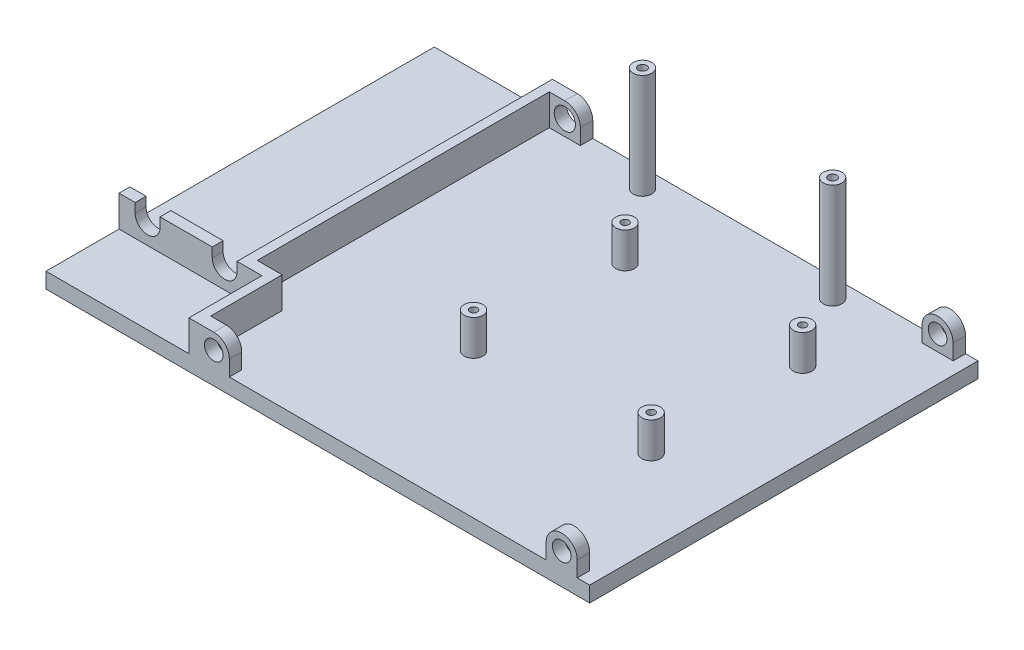
from build123d import *

# Parameters (mm, degrees)
SKETCH1_W           = 175
SKETCH1_H           = 125
BOSS_EXTRUDE1_DEPTH = 5
BOSS_EXTRUDE2_DEPTH = 10
SKETCH3_R           = 3.41
SKETCH3_R_2         = 3
BOSS_EXTRUDE3_DEPTH = 4
BOSS_EXTRUDE4_START = -4
SKETCH4_R           = 3
BOSS_EXTRUDE4_DEPTH = 4
SKETCH5_R           = 3
SKETCH5_R_2         = 1.2
BOSS_EXTRUDE5_DEPTH = 11.4
SKETCH6_R           = 3
SKETCH6_R_2         = 1.35
BOSS_EXTRUDE6_DEPTH = 33.7
CUT_EXTRUDE1_REACH  = 138.96


with BuildPart() as part:
    # Sketch1 → Boss-Extrude1 (new body)
    with BuildSketch(Plane(origin=(0, 0, 0), x_dir=(1, 0, 0), z_dir=(0, 1, 0))):
        Rectangle(SKETCH1_W, SKETCH1_H)
    extrude(amount=BOSS_EXTRUDE1_DEPTH)

    # Sketch2 → Boss-Extrude2 (add)
    with BuildSketch(Plane(origin=(0, 5, 0), x_dir=(1, 0, 0), z_dir=(0, 1, 0))):
        Polygon((-49.5, 62.5), (-49.5, -35.5), (-87.5, -35.5), (-87.5, -39), (-41.5, -39), (-41.5, -62.5), (-38.5, -62.5), (-38.5, -35.5), (-46.5, -35.5), (-46.5, 62.5), align=None)
    extrude(amount=BOSS_EXTRUDE2_DEPTH)

    # Sketch3 → Boss-Extrude3 (add)
    # profile 1 of 2: a face of its own
    with BuildSketch(Plane(origin=(0, 0, -62.5), x_dir=(-1, 0, 0), z_dir=(0, 0, -1))):
        with BuildLine():
            Line((46.5, 5), (36.5, 5))
            Line((36.5, 5), (36.5, 10))
            ThreePointArc((36.5, 10), (37.964466094, 13.535533906), (41.5, 15))
            Line((41.5, 15), (46.5, 15))
            Line((46.5, 15), (46.5, 5))
        make_face()
        with Locations((41.5, 10)):
            Circle(SKETCH3_R, mode=Mode.SUBTRACT)
    # profile 2 of 2: a face of its own
    with BuildSketch(Plane(origin=(0, 0, -62.5), x_dir=(-1, 0, 0), z_dir=(0, 0, -1))):
        with BuildLine():
            Line((-83.5, 10), (-83.5, 5))
            Line((-83.5, 5), (-73.5, 5))
            Line((-73.5, 5), (-73.5, 10))
            ThreePointArc((-73.5, 10), (-78.5, 15), (-83.5, 10))
        make_face()
        with Locations(Location((-78.5, 10, 0), (0, 0, 180))):
            Circle(SKETCH3_R_2, mode=Mode.SUBTRACT)
    extrude(amount=-BOSS_EXTRUDE3_DEPTH)

    # Sketch4 → Boss-Extrude4 (add)
    # profile 1 of 2: a face of its own
    with BuildSketch(Plane.XY.offset(62.5).offset(BOSS_EXTRUDE4_START)):
        with BuildLine():
            Line((73.5, 5), (83.5, 5))
            Line((83.5, 5), (83.5, 10))
            ThreePointArc((83.5, 10), (78.5, 15), (73.5, 10))
            Line((73.5, 10), (73.5, 5))
        make_face()
        with Locations((78.5, 10)):
            Circle(SKETCH4_R, mode=Mode.SUBTRACT)
    # profile 2 of 2: a face of its own
    with BuildSketch(Plane.XY.offset(62.5).offset(BOSS_EXTRUDE4_START)):
        with BuildLine():
            Line((-38.5, 15), (-38.5, 5))
            Line((-38.5, 5), (-28.5, 5))
            Line((-28.5, 5), (-28.5, 10))
            ThreePointArc((-28.5, 10), (-29.964466094, 13.535533906), (-33.5, 15))
            Line((-33.5, 15), (-38.5, 15))
        make_face()
        with Locations((-33.5, 10)):
            Circle(SKETCH4_R, mode=Mode.SUBTRACT)
    extrude(amount=BOSS_EXTRUDE4_DEPTH)

    # Sketch5 → Boss-Extrude5 (add)
    # profile 1 of 4: a face of its own
    with BuildSketch(Plane(origin=(0, 5, 0), x_dir=(1, 0, 0), z_dir=(0, 1, 0))):
        with Locations(Location((3.5, 32.9, 0), (0, 0, 90))):
            Circle(SKETCH5_R)
        with Locations(Location((3.5, 32.9, 0), (0, 0, 90))):
            Circle(SKETCH5_R_2, mode=Mode.SUBTRACT)
    # profile 2 of 4: a face of its own
    with BuildSketch(Plane(origin=(0, 5, 0), x_dir=(1, 0, 0), z_dir=(0, 1, 0))):
        with Locations(Location((60.65, 32.9, 0), (0, 0, 90))):
            Circle(SKETCH5_R)
        with Locations(Location((60.65, 32.9, 0), (0, 0, 90))):
            Circle(SKETCH5_R_2, mode=Mode.SUBTRACT)
    # profile 3 of 4: a face of its own
    with BuildSketch(Plane(origin=(0, 5, 0), x_dir=(1, 0, 0), z_dir=(0, 1, 0))):
        with Locations(Location((60.65, -15.868, 0), (0, 0, 90))):
            Circle(SKETCH5_R)
        with Locations(Location((60.65, -15.868, 0), (0, 0, 90))):
            Circle(SKETCH5_R_2, mode=Mode.SUBTRACT)
    # profile 4 of 4: a face of its own
    with BuildSketch(Plane(origin=(0, 5, 0), x_dir=(1, 0, 0), z_dir=(0, 1, 0))):
        with Locations(Location((3.5, -15.868, 0), (0, 0, 90))):
            Circle(SKETCH5_R)
        with Locations(Location((3.5, -15.868, 0), (0, 0, 90))):
            Circle(SKETCH5_R_2, mode=Mode.SUBTRACT)
    extrude(amount=BOSS_EXTRUDE5_DEPTH)

    # Sketch6 → Boss-Extrude6 (add)
    # profile 1 of 2: a face of its own
    with BuildSketch(Plane(origin=(0, 5, 0), x_dir=(1, 0, 0), z_dir=(0, 1, 0))):
        with Locations(Location((46.7, 56.5, 0), (0, 0, 270))):
            Circle(SKETCH6_R)
        with Locations(Location((46.7, 56.5, 0), (0, 0, 270))):
            Circle(SKETCH6_R_2, mode=Mode.SUBTRACT)
    # profile 2 of 2: a face of its own
    with BuildSketch(Plane(origin=(0, 5, 0), x_dir=(1, 0, 0), z_dir=(0, 1, 0))):
        with Locations(Location((-14.5, 56.5, 0), (0, 0, 270))):
            Circle(SKETCH6_R)
        with Locations(Location((-14.5, 56.5, 0), (0, 0, 270))):
            Circle(SKETCH6_R_2, mode=Mode.SUBTRACT)
    extrude(amount=BOSS_EXTRUDE6_DEPTH)

    # Sketch7 → Cut-Extrude1 (cut, up to next)
    with BuildSketch(Plane(origin=(0, 0, 35.5), x_dir=(-1, 0, 0), z_dir=(0, 0, -1)), mode=Mode.PRIVATE) as cut_extrude1_sk1:
        with BuildLine():
            Line((49.5, 15), (49.5, 12))
            ThreePointArc((49.5, 12), (53.5, 8), (57.5, 12))
            Line((57.5, 12), (57.5, 15))
            Line((57.5, 15), (49.5, 15))
        make_face()
    cut_extrude1_tool1 = extrude(cut_extrude1_sk1.sketch, amount=-CUT_EXTRUDE1_REACH, mode=Mode.PRIVATE) & part.part
    # Sketch7 → Cut-Extrude1 (cut, up to next)
    with BuildSketch(Plane(origin=(0, 0, 35.5), x_dir=(-1, 0, 0), z_dir=(0, 0, -1)), mode=Mode.PRIVATE) as cut_extrude1_sk2:
        with BuildLine():
            Line((74.3, 15), (74.3, 12))
            ThreePointArc((74.3, 12), (78.3, 8), (82.3, 12))
            Line((82.3, 12), (82.3, 15))
            Line((82.3, 15), (74.3, 15))
        make_face()
    cut_extrude1_tool2 = extrude(cut_extrude1_sk2.sketch, amount=-CUT_EXTRUDE1_REACH, mode=Mode.PRIVATE) & part.part
    add(cut_extrude1_tool1.solids().sort_by_distance((-53.5, 11.864313, 35.5))[0], mode=Mode.SUBTRACT)
    add(cut_extrude1_tool2.solids().sort_by_distance((-78.3, 11.864313, 35.5))[0], mode=Mode.SUBTRACT)


solid = part.part
